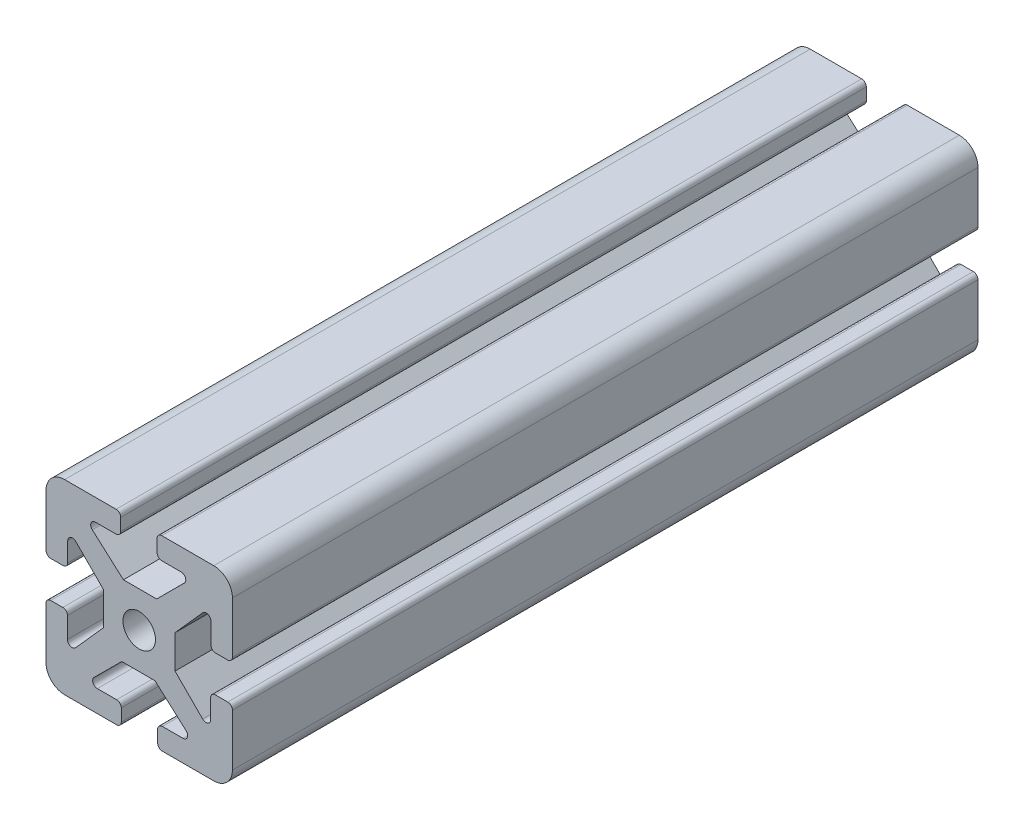
from build123d import *

# Parameters (mm, degrees)
SKETCH2_R           = 3.492543695
BOSS_EXTRUDE1_DEPTH = 160


with BuildPart() as part:
    # Sketch2 → Boss-Extrude1 (new body)
    with BuildSketch(Plane.XY):
        with BuildLine():
            Line((19.48831917, 27.684671829), (23.749889801, 27.684671829))
            Line((23.749889801, 27.684671829), (29.699681879, 33.624984685))
            ThreePointArc((29.699681879, 33.624984685), (29.917171057, 34.714970099), (28.993139054, 35.332654972))
            Line((28.993139054, 35.332654972), (24.845630957, 35.332654972))
            ThreePointArc((24.845630957, 35.332654972), (24.138524175, 35.625548191), (23.845630957, 36.332654972))
            Line((23.845630957, 36.332654972), (23.845630957, 39))
            ThreePointArc((23.845630957, 39), (24.138524175, 39.707106781), (24.845630957, 40))
            Line((24.845630957, 40), (36, 40))
            ThreePointArc((36, 40), (38.828427125, 38.828427125), (40, 36))
            Line((40, 36), (40, 24.961087436))
            ThreePointArc((40, 24.961087436), (39.707106781, 24.253980655), (39, 23.961087436))
            Line((39, 23.961087436), (36.388269628, 23.961087436))
            ThreePointArc((36.388269628, 23.961087436), (35.681162846, 24.253980655), (35.388269628, 24.961087436))
            Line((35.388269628, 24.961087436), (35.388269628, 29.408620307))
            ThreePointArc((35.388269628, 29.408620307), (34.744223919, 30.343123673), (33.641676542, 30.073901274))
            Line((33.641676542, 30.073901274), (27.684671829, 23.388818206))
            Line((27.684671829, 23.388818206), (27.684671829, 20.51168083))
            Line((27.684671829, 20.51168083), (27.684671829, 16.250110199))
            Line((27.684671829, 16.250110199), (33.624984685, 10.300318121))
            ThreePointArc((33.624984685, 10.300318121), (34.714970099, 10.082828943), (35.332654972, 11.006860946))
            Line((35.332654972, 11.006860946), (35.332654972, 15.154369043))
            ThreePointArc((35.332654972, 15.154369043), (35.625548191, 15.861475825), (36.332654972, 16.154369043))
            Line((36.332654972, 16.154369043), (39, 16.154369043))
            ThreePointArc((39, 16.154369043), (39.707106781, 15.861475825), (40, 15.154369043))
            Line((40, 15.154369043), (40, 4))
            ThreePointArc((40, 4), (38.828427125, 1.171572875), (36, 0))
            Line((36, 0), (24.961087436, 0))
            ThreePointArc((24.961087436, 0), (24.253980655, 0.292893219), (23.961087436, 1))
            Line((23.961087436, 1), (23.961087436, 3.611730372))
            ThreePointArc((23.961087436, 3.611730372), (24.253980655, 4.318837154), (24.961087436, 4.611730372))
            Line((24.961087436, 4.611730372), (29.408620307, 4.611730372))
            ThreePointArc((29.408620307, 4.611730372), (30.343123673, 5.255776081), (30.073901274, 6.358323458))
            Line((30.073901274, 6.358323458), (23.388818206, 12.315328171))
            Line((23.388818206, 12.315328171), (20.51168083, 12.315328171))
            Line((20.51168083, 12.315328171), (16.250110199, 12.315328171))
            Line((16.250110199, 12.315328171), (10.300318121, 6.375015315))
            ThreePointArc((10.300318121, 6.375015315), (10.082828943, 5.285029901), (11.006860946, 4.667345028))
            Line((11.006860946, 4.667345028), (15.154369043, 4.667345028))
            ThreePointArc((15.154369043, 4.667345028), (15.861475825, 4.374451809), (16.154369043, 3.667345028))
            Line((16.154369043, 3.667345028), (16.154369043, 1))
            ThreePointArc((16.154369043, 1), (15.861475825, 0.292893219), (15.154369043, 0))
            Line((15.154369043, 0), (4, 0))
            ThreePointArc((4, 0), (1.171572875, 1.171572875), (0, 4))
            Line((0, 4), (0, 15.038912564))
            ThreePointArc((0, 15.038912564), (0.292893219, 15.746019345), (1, 16.038912564))
            Line((1, 16.038912564), (3.611730372, 16.038912564))
            ThreePointArc((3.611730372, 16.038912564), (4.318837154, 15.746019345), (4.611730372, 15.038912564))
            Line((4.611730372, 15.038912564), (4.611730372, 10.591379693))
            ThreePointArc((4.611730372, 10.591379693), (5.255776081, 9.656876327), (6.358323458, 9.926098726))
            Line((6.358323458, 9.926098726), (12.315328171, 16.611181794))
            Line((12.315328171, 16.611181794), (12.315328171, 19.48831917))
            Line((12.315328171, 19.48831917), (12.315328171, 23.749889801))
            Line((12.315328171, 23.749889801), (6.375015315, 29.699681879))
            ThreePointArc((6.375015315, 29.699681879), (5.285029901, 29.917171057), (4.667345028, 28.993139054))
            Line((4.667345028, 28.993139054), (4.667345028, 24.845630957))
            ThreePointArc((4.667345028, 24.845630957), (4.374451809, 24.138524175), (3.667345028, 23.845630957))
            Line((3.667345028, 23.845630957), (1, 23.845630957))
            ThreePointArc((1, 23.845630957), (0.292893219, 24.138524175), (0, 24.845630957))
            Line((0, 24.845630957), (0, 36))
            ThreePointArc((0, 36), (1.171572875, 38.828427125), (4, 40))
            Line((4, 40), (15.038912564, 40))
            ThreePointArc((15.038912564, 40), (15.746019345, 39.707106781), (16.038912564, 39))
            Line((16.038912564, 39), (16.038912564, 36.388269628))
            ThreePointArc((16.038912564, 36.388269628), (15.746019345, 35.681162846), (15.038912564, 35.388269628))
            Line((15.038912564, 35.388269628), (10.591379693, 35.388269628))
            ThreePointArc((10.591379693, 35.388269628), (9.656876327, 34.744223919), (9.926098726, 33.641676542))
            Line((9.926098726, 33.641676542), (16.611181794, 27.684671829))
            Line((16.611181794, 27.684671829), (19.48831917, 27.684671829))
        make_face()
        with Locations((20, 20)):
            Circle(SKETCH2_R, mode=Mode.SUBTRACT)
    extrude(amount=BOSS_EXTRUDE1_DEPTH)


solid = part.part
